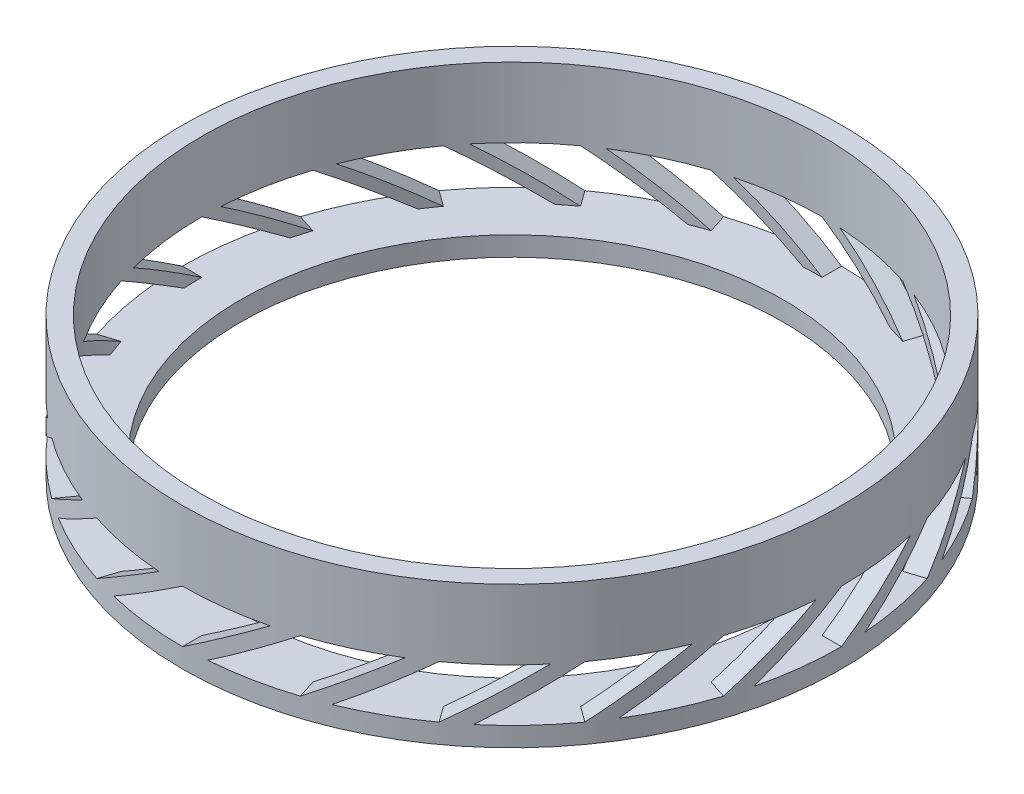
from build123d import *

# Parameters (mm, degrees)
SKETCH2_R               = 26.9875
BOSS_EXTRUDE1_DEPTH     = 11.5951
SHELL1_T                = -1.5875
CUT_EXTRUDE1_DEPTH      = 40.456334983
CUT_EXTRUDE1_DEPTH_BACK = 40.456334983
SKETCH5_R               = 22.225
CUT_EXTRUDE2_DEPTH      = 38.1
CIRPATTERN3_COUNT       = 20


with BuildPart() as part:
    # Sketch2 → Boss-Extrude1 (new body)
    with BuildSketch(Plane(origin=(0, 0, 0), x_dir=(1, 0, 0), z_dir=(0, 1, 0))):
        Circle(SKETCH2_R)
    extrude(amount=BOSS_EXTRUDE1_DEPTH)

    # Shell1
    shell1_openings = [part.faces().sort_by_distance(p)[0] for p in [
        (0, 11.5951, 0),
    ]]
    offset(amount=SHELL1_T, openings=shell1_openings, kind=Kind.INTERSECTION)

    # Sketch5 → Cut-Extrude1 (cut, two sides: drawn at the far end of the back side and taken through both)
    with BuildSketch(Plane(origin=(0, 1.5875, 0), x_dir=(1, 0, 0), z_dir=(0, 1, 0)).offset(-CUT_EXTRUDE1_DEPTH_BACK)):
        Circle(SKETCH5_R)
    extrude(amount=CUT_EXTRUDE1_DEPTH + CUT_EXTRUDE1_DEPTH_BACK, mode=Mode.SUBTRACT)

    # Sketch6 → Cut-Extrude2 (cut)
    with BuildSketch(Plane.XY):
        Polygon((6.413577678, 1.5875), (0, 5.8801), (-6.413577678, 5.8801), (0, 1.5875), align=None)
    cut_extrude2 = extrude(amount=-CUT_EXTRUDE2_DEPTH, mode=Mode.SUBTRACT)

    # CirPattern3: Cut-Extrude2 ×20 about axis
    cirpattern3_axis = Axis((0, 11.5951, 0), (0, -1, 0))
    for i in range(1, CIRPATTERN3_COUNT):
        add(cut_extrude2.rotate(cirpattern3_axis, i * 360 / CIRPATTERN3_COUNT), mode=Mode.SUBTRACT)


solid = part.part
